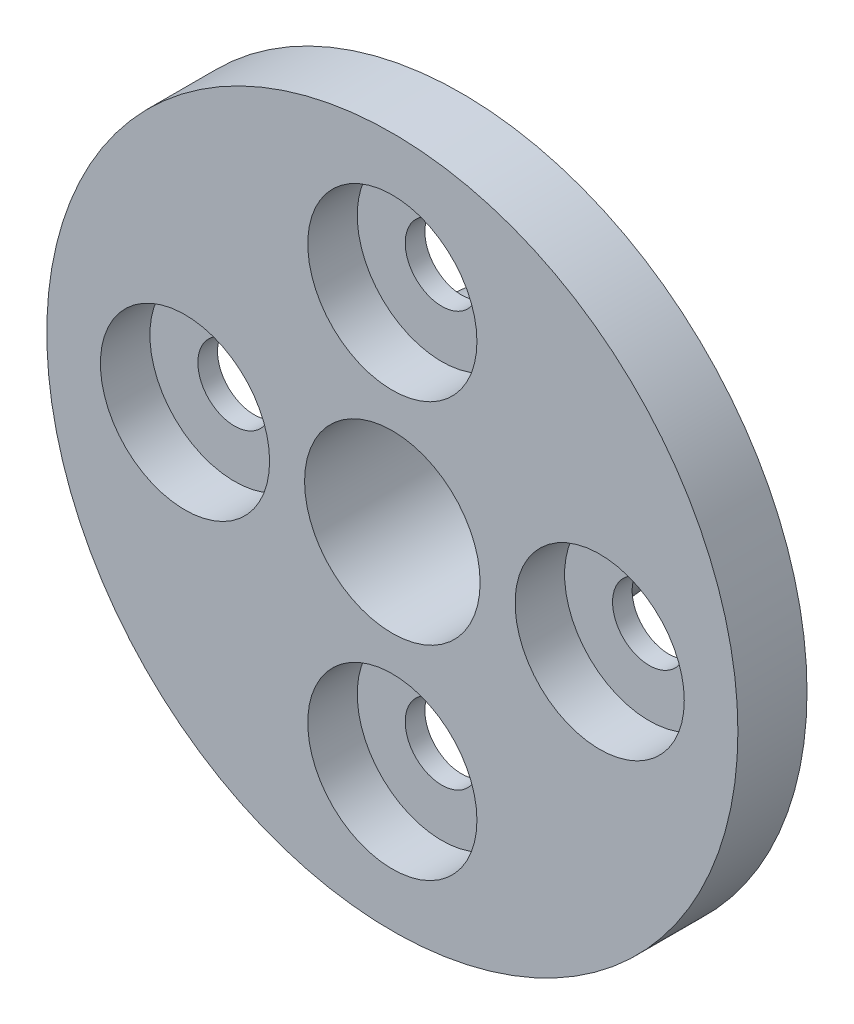
from build123d import *
from build123d.topology import SkipClean

# Parameters (mm, degrees)
SKETCH1_R                               = 25
SKETCH1_R_2                             = 6.35
BOSS_EXTRUDE1_DEPTH                     = 5
BOSS_EXTRUDE2_START                     = 6
SKETCH2_R                               = 9
SKETCH2_R_2                             = 6.35
BOSS_EXTRUDE2_DEPTH                     = 6
CBORE_FOR_M5_HEX_HEAD_BOLT1_D           = 5.3
CBORE_FOR_M5_HEX_HEAD_BOLT1_DEPTH       = 19.75
CBORE_FOR_M5_HEX_HEAD_BOLT1_CBORE_D     = 12.24
CBORE_FOR_M5_HEX_HEAD_BOLT1_CBORE_DEPTH = 3.58
CBORE_FOR_M5_HEX_HEAD_BOLT1_TIP         = 1.59228064


with BuildPart() as part:
    # Sketch1 → Boss-Extrude1 (new body)
    with BuildSketch(Plane.XY):
        Circle(SKETCH1_R)
        Circle(SKETCH1_R_2, mode=Mode.SUBTRACT)
    extrude(amount=BOSS_EXTRUDE1_DEPTH)

    # Sketch2 → Boss-Extrude2 (add)
    with SkipClean():  # the faces are left unmerged after this step: merging them gives an invalid solid
        with BuildSketch(Plane(origin=(0, 0, 0), x_dir=(-1, 0, 0), z_dir=(0, 0, -1)).offset(BOSS_EXTRUDE2_START)):
            with Locations(Location((0, 0, 0), (0, 0, 180))):
                Circle(SKETCH2_R)
            Circle(SKETCH2_R_2, mode=Mode.SUBTRACT)
        extrude(amount=-BOSS_EXTRUDE2_DEPTH)

    # CBORE for M5 Hex Head Bolt1
    with Locations(Plane.XY.offset(5)):
        with Locations((0, 15), (15, 0), (0, -15), (-15, 0)):
            CounterBoreHole(CBORE_FOR_M5_HEX_HEAD_BOLT1_D / 2, CBORE_FOR_M5_HEX_HEAD_BOLT1_CBORE_D / 2, CBORE_FOR_M5_HEX_HEAD_BOLT1_CBORE_DEPTH, depth=CBORE_FOR_M5_HEX_HEAD_BOLT1_DEPTH)
            with Locations((0, 0, -(CBORE_FOR_M5_HEX_HEAD_BOLT1_DEPTH + CBORE_FOR_M5_HEX_HEAD_BOLT1_TIP / 2))):  # 118° drill point
                Cone(0, CBORE_FOR_M5_HEX_HEAD_BOLT1_D / 2, CBORE_FOR_M5_HEX_HEAD_BOLT1_TIP, mode=Mode.SUBTRACT)


solid = part.part
